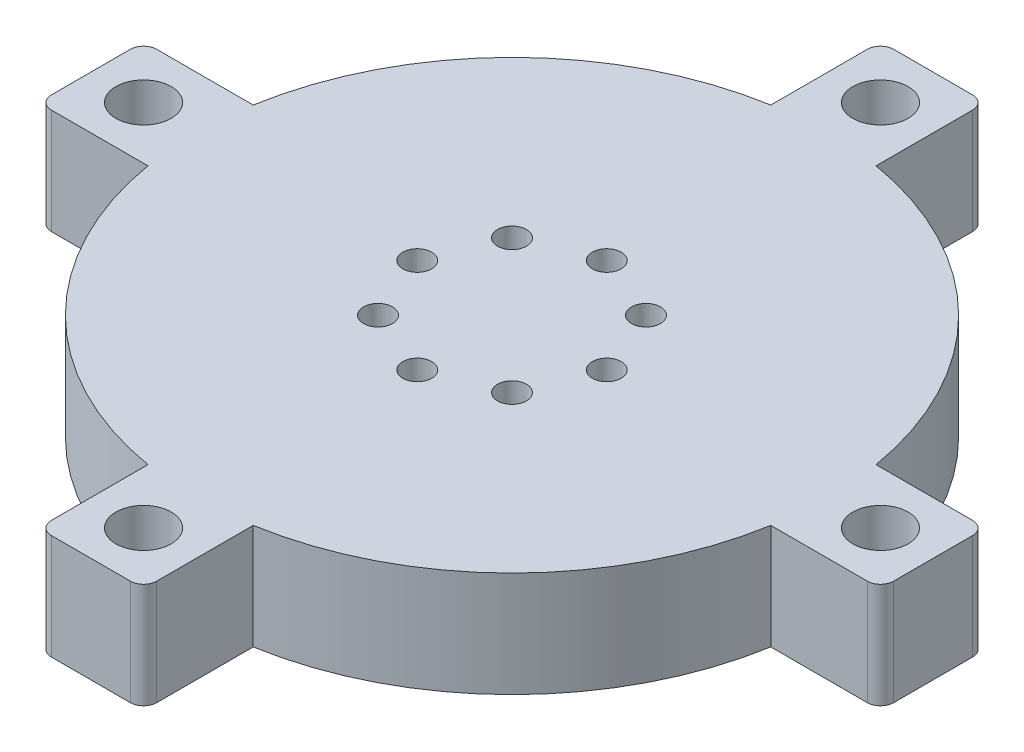
from build123d import *

# Parameters (mm, degrees)
SKETCH1_W                               = 20
SKETCH1_H                               = 20
BOSS_EXTRUDE1_DEPTH                     = 20
CBORE_FOR_M5_HEX_HEAD_BOLT1_D           = 5.5
CBORE_FOR_M5_HEX_HEAD_BOLT1_CBORE_D     = 10.5
CBORE_FOR_M5_HEX_HEAD_BOLT1_CBORE_DEPTH = 10
CBORE_FOR_M5_HEX_HEAD_BOLT3_D           = 5.5
CBORE_FOR_M5_HEX_HEAD_BOLT3_CBORE_D     = 10.5
CBORE_FOR_M5_HEX_HEAD_BOLT3_CBORE_DEPTH = 14


with BuildPart() as part:
    # Sketch1 → Boss-Extrude1 (new body)
    with BuildSketch(Plane(origin=(0, 0, 0), x_dir=(1, 0, 0), z_dir=(0, 1, 0))):
        with BuildLine():
            ThreePointArc((-59.160797831, -10), (-60, 0), (-59.160797831, 10))
            Line((-59.160797831, 10), (-77.5, 10))
            ThreePointArc((-77.5, 10), (-79.267766953, 9.267766953), (-80, 7.5))
            Line((-80, 7.5), (-80, -7.5))
            ThreePointArc((-80, -7.5), (-79.267766953, -9.267766953), (-77.5, -10))
            Line((-77.5, -10), (-59.160797831, -10))
        make_face()
        with BuildLine():
            Line((-10, 10), (-10, 59.160797831))
            ThreePointArc((-10, 59.160797831), (-42.426406871, 42.426406871), (-59.160797831, 10))
            Line((-59.160797831, 10), (-10, 10))
        make_face()
        with BuildLine():
            Line((7.5, 80), (-7.5, 80))
            ThreePointArc((-7.5, 80), (-9.267766953, 79.267766953), (-10, 77.5))
            Line((-10, 77.5), (-10, 59.160797831))
            ThreePointArc((-10, 59.160797831), (0, 60), (10, 59.160797831))
            Line((10, 59.160797831), (10, 77.5))
            ThreePointArc((10, 77.5), (9.267766953, 79.267766953), (7.5, 80))
        make_face()
        with BuildLine():
            ThreePointArc((10, 59.160797831), (0, 60), (-10, 59.160797831))
            Line((-10, 59.160797831), (-10, 10))
            Line((-10, 10), (10, 10))
            Line((10, 10), (10, 59.160797831))
        make_face()
        with BuildLine():
            ThreePointArc((59.160797831, 10), (42.426406871, 42.426406871), (10, 59.160797831))
            Line((10, 59.160797831), (10, 10))
            Line((10, 10), (59.160797831, 10))
        make_face()
        with BuildLine():
            Line((77.5, 10), (59.160797831, 10))
            ThreePointArc((59.160797831, 10), (59.789831367, 5.017575617), (60, 0))
            ThreePointArc((60, 0), (59.789831367, -5.017575617), (59.160797831, -10))
            Line((59.160797831, -10), (77.5, -10))
            ThreePointArc((77.5, -10), (79.267766953, -9.267766953), (80, -7.5))
            Line((80, -7.5), (80, 7.5))
            ThreePointArc((80, 7.5), (79.267766953, 9.267766953), (77.5, 10))
        make_face()
        with BuildLine():
            Line((59.160797831, 10), (10, 10))
            Line((10, 10), (10, -10))
            Line((10, -10), (59.160797831, -10))
            ThreePointArc((59.160797831, -10), (59.789831367, -5.017575617), (60, 0))
            ThreePointArc((60, 0), (59.789831367, 5.017575617), (59.160797831, 10))
        make_face()
        Rectangle(SKETCH1_W, SKETCH1_H)
        with BuildLine():
            Line((-10, -10), (-10, 10))
            Line((-10, 10), (-59.160797831, 10))
            ThreePointArc((-59.160797831, 10), (-60, 0), (-59.160797831, -10))
            Line((-59.160797831, -10), (-10, -10))
        make_face()
        with BuildLine():
            Line((-10, -59.160797831), (-10, -10))
            Line((-10, -10), (-59.160797831, -10))
            ThreePointArc((-59.160797831, -10), (-42.426406871, -42.426406871), (-10, -59.160797831))
        make_face()
        with BuildLine():
            Line((59.160797831, -10), (10, -10))
            Line((10, -10), (10, -59.160797831))
            ThreePointArc((10, -59.160797831), (42.426406871, -42.426406871), (59.160797831, -10))
        make_face()
        with BuildLine():
            Line((10, -10), (-10, -10))
            Line((-10, -10), (-10, -59.160797831))
            ThreePointArc((-10, -59.160797831), (0, -60), (10, -59.160797831))
            Line((10, -59.160797831), (10, -10))
        make_face()
        with BuildLine():
            ThreePointArc((10, -59.160797831), (0, -60), (-10, -59.160797831))
            Line((-10, -59.160797831), (-10, -77.5))
            ThreePointArc((-10, -77.5), (-9.267766953, -79.267766953), (-7.5, -80))
            Line((-7.5, -80), (7.5, -80))
            ThreePointArc((7.5, -80), (9.267766953, -79.267766953), (10, -77.5))
            Line((10, -77.5), (10, -59.160797831))
        make_face()
    extrude(amount=BOSS_EXTRUDE1_DEPTH)

    # CBORE for M5 Hex Head Bolt1 (through all)
    with Locations(Plane(origin=(0, 20, -70), x_dir=(0, 0, 1), z_dir=(0, 1, 0))):
        with Locations((0, 0), (70, 70), (70, -70), (140, 0)):
            CounterBoreHole(CBORE_FOR_M5_HEX_HEAD_BOLT1_D / 2, CBORE_FOR_M5_HEX_HEAD_BOLT1_CBORE_D / 2, CBORE_FOR_M5_HEX_HEAD_BOLT1_CBORE_DEPTH)

    # CBORE for M5 Hex Head Bolt3 (through all)
    with Locations(Plane(origin=(0, 0, -18), x_dir=(0, 0, -1), z_dir=(0, -1, 0))):
        with Locations((0, 0), (-5.272077939, -12.727922061), (-18, -18), (-30.727922061, -12.727922061), (-36, 0), (-30.727922061, 12.727922061), (-18, 18), (-5.272077939, 12.727922061)):
            CounterBoreHole(CBORE_FOR_M5_HEX_HEAD_BOLT3_D / 2, CBORE_FOR_M5_HEX_HEAD_BOLT3_CBORE_D / 2, CBORE_FOR_M5_HEX_HEAD_BOLT3_CBORE_DEPTH)


solid = part.part
